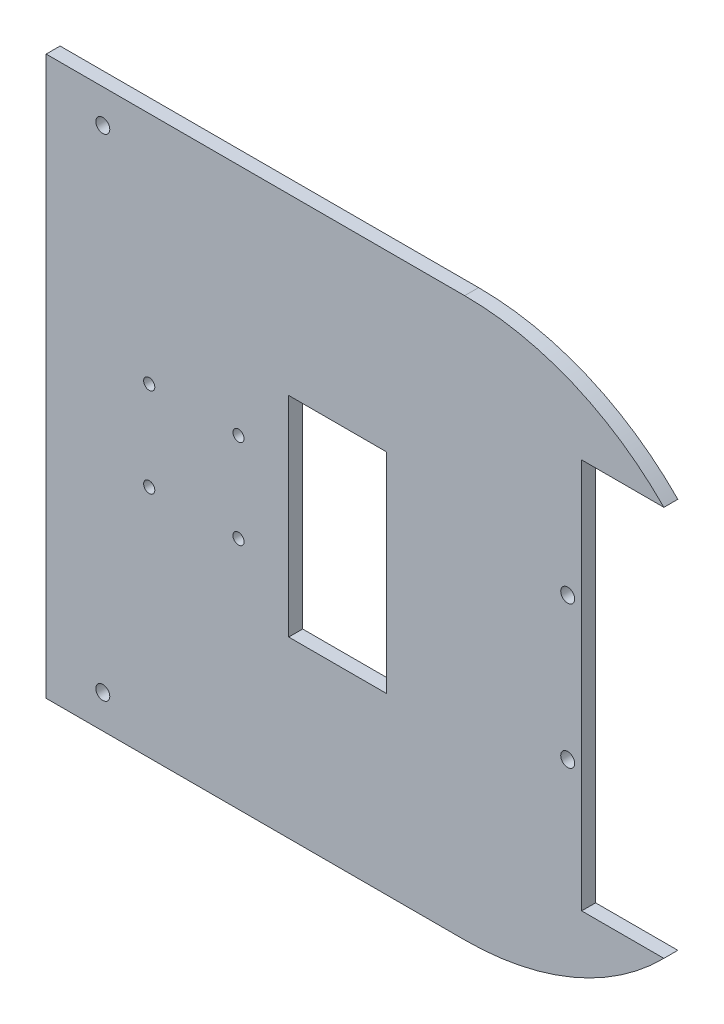
from build123d import *

# Parameters (mm, degrees)
BOSS_EXTRUDE1_DEPTH = 5
SKETCH2_R           = 2.5
SKETCH2_W           = 35
SKETCH2_H           = 75
CUT_EXTRUDE1_DEPTH  = 10
SKETCH4_R           = 2
CUT_EXTRUDE3_DEPTH  = 10
SKETCH5_R           = 2.5
CUT_EXTRUDE4_DEPTH  = 10
SKETCH6_W           = 242.754098284
SKETCH6_H           = 200
CUT_EXTRUDE5_DEPTH  = 10


with BuildPart() as part:
    # Sketch1 → Boss-Extrude1 (new body)
    with BuildSketch(Plane.XY):
        with BuildLine():
            Line((77, 150.635083269), (106.477021815, 150.635083269))
            ThreePointArc((106.477021815, 150.635083269), (73.792570992, 172.830527842), (35.06273753, 180.635083269))
            Line((35.06273753, 180.635083269), (-264.93726247, 180.635083269))
            ThreePointArc((-264.93726247, 180.635083269), (-303.667095932, 172.830527842), (-336.351546756, 150.635083269))
            Line((-336.351546756, 150.635083269), (-306.874524941, 150.635083269))
            Line((-306.874524941, 150.635083269), (-306.874524941, 10.635083269))
            Line((-306.874524941, 10.635083269), (-336.351546756, 10.635083269))
            ThreePointArc((-336.351546756, 10.635083269), (-303.667095932, -11.560361304), (-264.93726247, -19.364916731))
            Line((-264.93726247, -19.364916731), (35.06273753, -19.364916731))
            ThreePointArc((35.06273753, -19.364916731), (73.792570992, -11.560361304), (106.477021815, 10.635083269))
            Line((106.477021815, 10.635083269), (77, 10.635083269))
            Line((77, 10.635083269), (77, 150.635083269))
        make_face()
    extrude(amount=-BOSS_EXTRUDE1_DEPTH)

    # Sketch2 → Cut-Extrude1 (cut)
    with BuildSketch(Plane(origin=(0, 0, -5), x_dir=(-1, 0, 0), z_dir=(0, 0, -1))):
        with Locations((301.874524941, 106.135083269)):
            Circle(SKETCH2_R)
        with Locations(Location((301.874524941, 55.135083269, 0), (0, 0, 180))):
            Circle(SKETCH2_R)
        with Locations((-72, 55.135083269)):
            Circle(SKETCH2_R)
        with Locations(Location((-72, 106.135083269, 0), (0, 0, 180))):
            Circle(SKETCH2_R)
        with Locations((219.374524941, 80.635083269)):
            Rectangle(SKETCH2_W, SKETCH2_H)
        with Locations((10.5, 80.635083269)):
            Rectangle(SKETCH2_W, SKETCH2_H)
    extrude(amount=-CUT_EXTRUDE1_DEPTH, mode=Mode.SUBTRACT)

    # Sketch4 → Cut-Extrude3 (cut)
    with BuildSketch(Plane(origin=(0, 0, -5), x_dir=(-1, 0, 0), z_dir=(0, 0, -1))):
        with Locations((46, 64.695083269)):
            Circle(SKETCH4_R)
        with Locations((46, 96.695083269)):
            Circle(SKETCH4_R)
        with Locations((78, 64.695083269)):
            Circle(SKETCH4_R)
        with Locations((78, 96.695083269)):
            Circle(SKETCH4_R)
        with Locations(Location((151.874524941, 64.695083269, 0), (0, 0, 180))):
            Circle(SKETCH4_R)
        with Locations(Location((183.874524941, 64.695083269, 0), (0, 0, 180))):
            Circle(SKETCH4_R)
        with Locations(Location((183.874524941, 96.695083269, 0), (0, 0, 180))):
            Circle(SKETCH4_R)
        with Locations(Location((151.874524941, 96.695083269, 0), (0, 0, 180))):
            Circle(SKETCH4_R)
    extrude(amount=-CUT_EXTRUDE3_DEPTH, mode=Mode.SUBTRACT)

    # Sketch5 → Cut-Extrude4 (cut)
    with BuildSketch(Plane(origin=(0, 0, -5), x_dir=(-1, 0, 0), z_dir=(0, 0, -1))):
        with Locations((94.63726247, 168.635083269)):
            Circle(SKETCH5_R)
        with Locations((135.23726247, 168.635083269)):
            Circle(SKETCH5_R)
        with Locations(Location((94.63726247, -7.364916731, 0), (0, 0, 180))):
            Circle(SKETCH5_R)
        with Locations(Location((135.23726247, -7.364916731, 0), (0, 0, 180))):
            Circle(SKETCH5_R)
    extrude(amount=-CUT_EXTRUDE4_DEPTH, mode=Mode.SUBTRACT)

    # Sketch6 → Cut-Extrude5 (cut)
    with BuildSketch(Plane(origin=(0, 0, -5), x_dir=(-1, 0, 0), z_dir=(0, 0, -1))):
        with Locations((236.314311612, 80.635083269)):
            Rectangle(SKETCH6_W, SKETCH6_H)
    extrude(amount=-CUT_EXTRUDE5_DEPTH, mode=Mode.SUBTRACT)


solid = part.part
